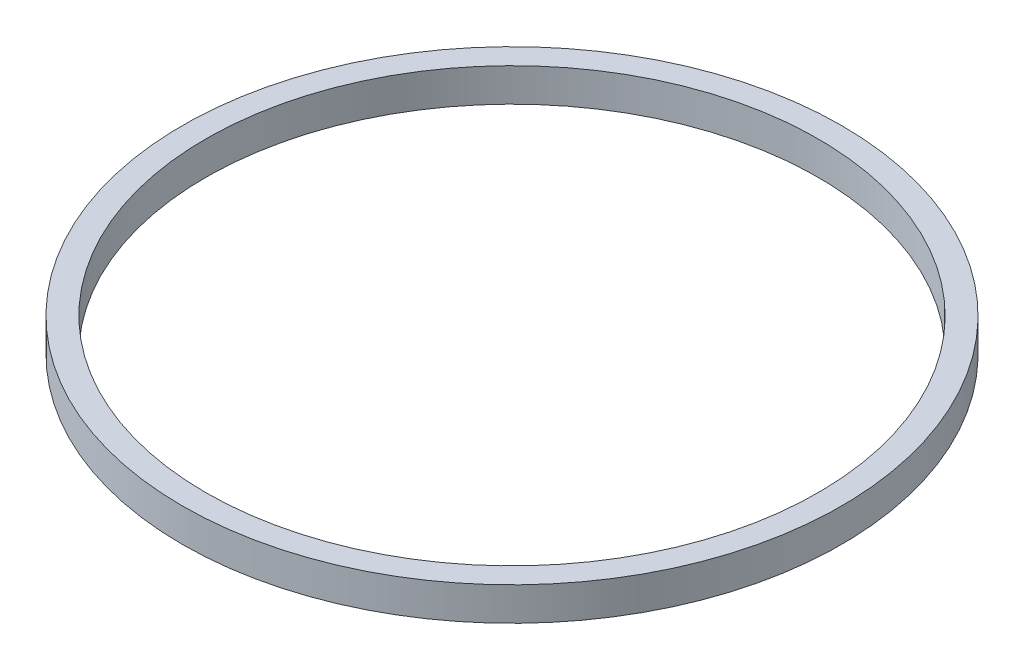
from build123d import *

# Parameters (mm, degrees)
SKETCH1_R           = 1079.5
SKETCH1_R_2         = 1003.3
BOSS_EXTRUDE1_DEPTH = 109.22


with BuildPart() as part:
    # Sketch1 → Boss-Extrude1 (new body)
    with BuildSketch(Plane(origin=(0, 0, 0), x_dir=(1, 0, 0), z_dir=(0, 1, 0))):
        with Locations(Location((0, 0, 0), (0, 0, 270))):
            Circle(SKETCH1_R)
        with Locations(Location((0, 0, 0), (0, 0, 270))):
            Circle(SKETCH1_R_2, mode=Mode.SUBTRACT)
    extrude(amount=BOSS_EXTRUDE1_DEPTH)


solid = part.part
